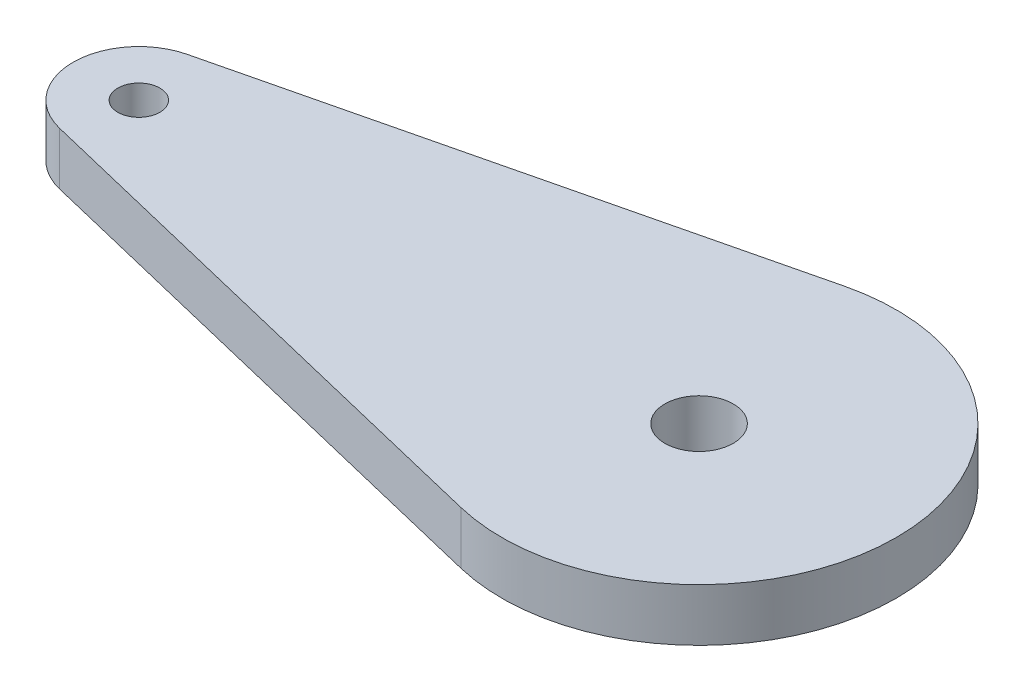
from build123d import *

# Parameters (mm, degrees)
SKETCH_1_R      = 1.6
SKETCH_1_R_2    = 2.6
EXTRUDE_1_DEPTH = 4


with BuildPart() as part:
    # ｽｹｯﾁ1 → ﾎﾞｽ - 押し出し1 (new body)
    with BuildSketch(Plane(origin=(0, 0, 0), x_dir=(1, 0, 0), z_dir=(0, 1, 0))):
        with BuildLine():
            Line((-1.17370892, -4.860288816), (39.078873239, -14.580866447))
            ThreePointArc((39.078873239, -14.580866447), (57.6, 0), (39.078873239, 14.580866447))
            Line((39.078873239, 14.580866447), (-1.17370892, 4.860288816))
            ThreePointArc((-1.17370892, 4.860288816), (-5, 0), (-1.17370892, -4.860288816))
        make_face()
        with Locations(Location((0, 0, 0), (0, 0, 270))):
            Circle(SKETCH_1_R, mode=Mode.SUBTRACT)
        with Locations(Location((42.6, 0, 0), (0, 0, 270))):
            Circle(SKETCH_1_R_2, mode=Mode.SUBTRACT)
    extrude(amount=EXTRUDE_1_DEPTH)


solid = part.part
